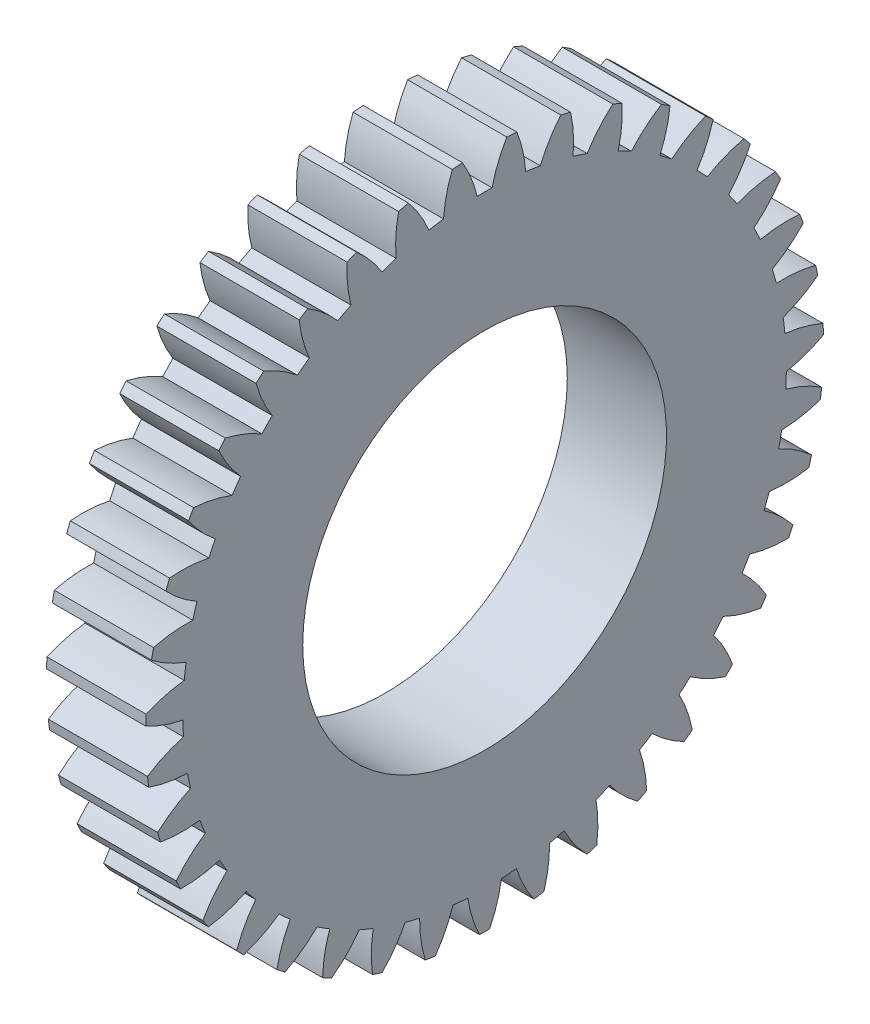
from build123d import *

# Parameters (mm, degrees)
BASPROSKE_W     = 6
BASPROSKE_H     = 20.5
TOOTHCUT_DEPTH  = 30.605742686
TEETHCUTS_COUNT = 39
TEETHCUTS_ANGLE = 350.769230769
BORSKE_R        = 11
BORE_DEPTH      = 50.0000508


with BuildPart() as part:
    # BasProSke → Base-Revolve (revolve)
    with BuildSketch(Plane(origin=(0, 0, 0), x_dir=(1, 0, 0), z_dir=(0, 1, 0)), mode=Mode.PRIVATE) as base_revolve_sk:
        with Locations((3, 10.25)):
            Rectangle(BASPROSKE_W, BASPROSKE_H)
    revolve(base_revolve_sk.sketch.rotate(Axis((-10, 0, 0), (1, 0, 0)), 180), axis=Axis((-10, 0, 0), (1, 0, 0)))

    # TooCutSke → ToothCut (cut, through all)
    with BuildSketch(Plane(origin=(0, 0, 0), x_dir=(0, 0, -1), z_dir=(1, 0, 0))):
        with BuildLine():
            ThreePointArc((0.450063598, 18.243449338), (0, 18.249), (-0.450063598, 18.243449338))
            ThreePointArc((-0.450063598, 18.243449338), (-0.816963734, 19.397278425), (-1.358007102, 20.480426311))
            ThreePointArc((-1.358007102, 20.480426311), (0, 20.5254), (1.358007102, 20.480426311))
            ThreePointArc((1.358007102, 20.480426311), (0.816963734, 19.397278425), (0.450063598, 18.243449338))
        make_face()
    toothcut = extrude(amount=TOOTHCUT_DEPTH, mode=Mode.SUBTRACT)

    # TeethCuts: ToothCut ×39 about axis
    teethcuts_axis = Axis((-10, 0, 0), (1, 0, 0))
    for i in range(1, TEETHCUTS_COUNT):
        add(toothcut.rotate(teethcuts_axis, i * TEETHCUTS_ANGLE / (TEETHCUTS_COUNT - 1)), mode=Mode.SUBTRACT)

    # BorSke → Bore (cut, symmetric)
    with BuildSketch(Plane(origin=(0, 0, 0), x_dir=(0, 0, -1), z_dir=(1, 0, 0))):
        with Locations(Location((0, 0, 0), (0, 0, 180))):
            Circle(BORSKE_R)
    extrude(amount=BORE_DEPTH, both=True, mode=Mode.SUBTRACT)


solid = part.part
